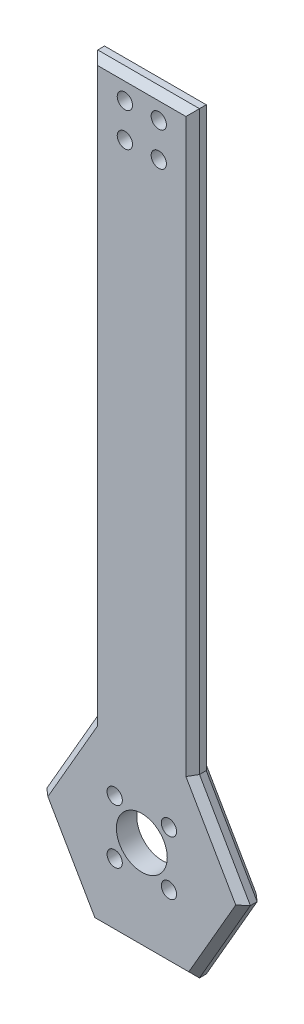
from build123d import *

# Parameters (mm, degrees)
SKETCH2_W           = 170
SKETCH2_H           = 30
BOSS_EXTRUDE2_DEPTH = 6
BOSS_EXTRUDE4_DEPTH = 6
CHAMFER1_SIZE       = 2
HOLE6_D             = 4.5
HOLE4_D             = 4.5
HOLE7_D             = 15


with BuildPart() as part:
    # Sketch2 → Boss-Extrude2 (new body)
    with BuildSketch(Plane(origin=(0, 0, 0), x_dir=(0, 1, 0), z_dir=(0, 0, 1))):
        Rectangle(SKETCH2_W, SKETCH2_H)
    extrude(amount=BOSS_EXTRUDE2_DEPTH)

    # Sketch8 → Boss-Extrude4 (add)
    with BuildSketch(Plane.XY.offset(6)):
        Polygon((-30, -110.980762114), (-15, -136.961524227), (15, -136.961524227), (30, -110.980762114), (15, -85), (-15, -85), align=None)
    extrude(amount=-BOSS_EXTRUDE4_DEPTH)

    # Chamfer1
    chamfer1_edges = [part.edges().sort_by_distance(p)[0] for p in [
        (-22.5, -97.990381057, 0),
        (22.5, -97.990381057, 0),
        (22.5, -123.97114317, 0),
        (0, -136.961524227, 0),
        (-22.5, -123.97114317, 0),
        (-22.5, -97.990381057, 6),
        (15, 0, 6),
        (-22.5, -123.97114317, 6),
        (0, -136.961524227, 6),
        (22.5, -123.97114317, 6),
        (22.5, -97.990381057, 6),
        (0, 85, 6),
        (15, 0, 0),
        (-15, 0, 0),
        (0, 85, 0),
        (-15, 0, 6),
    ]]
    chamfer(chamfer1_edges, length=CHAMFER1_SIZE)

    # Hole6 (through all)
    with Locations(Plane(origin=(0, 0, 0), x_dir=(-1, 0, 0), z_dir=(0, 0, -1))):
        with Locations((8, -116.961524227), (-8, -116.961524227), (-8, -100.961524227), (8, -100.961524227)):
            Hole(HOLE6_D / 2)

    # Hole4 (through all)
    with Locations(Plane.XY.offset(6)):
        with Locations((-5, 68), (5, 68), (5, 78), (-5, 78)):
            Hole(HOLE4_D / 2)

    # Hole7 (through all)
    with Locations(Plane(origin=(0, -108.961524227, 6), x_dir=(1, 0, 0), z_dir=(0, 0, 1))):
        with Locations((0, 0)):
            Hole(HOLE7_D / 2)


solid = part.part
